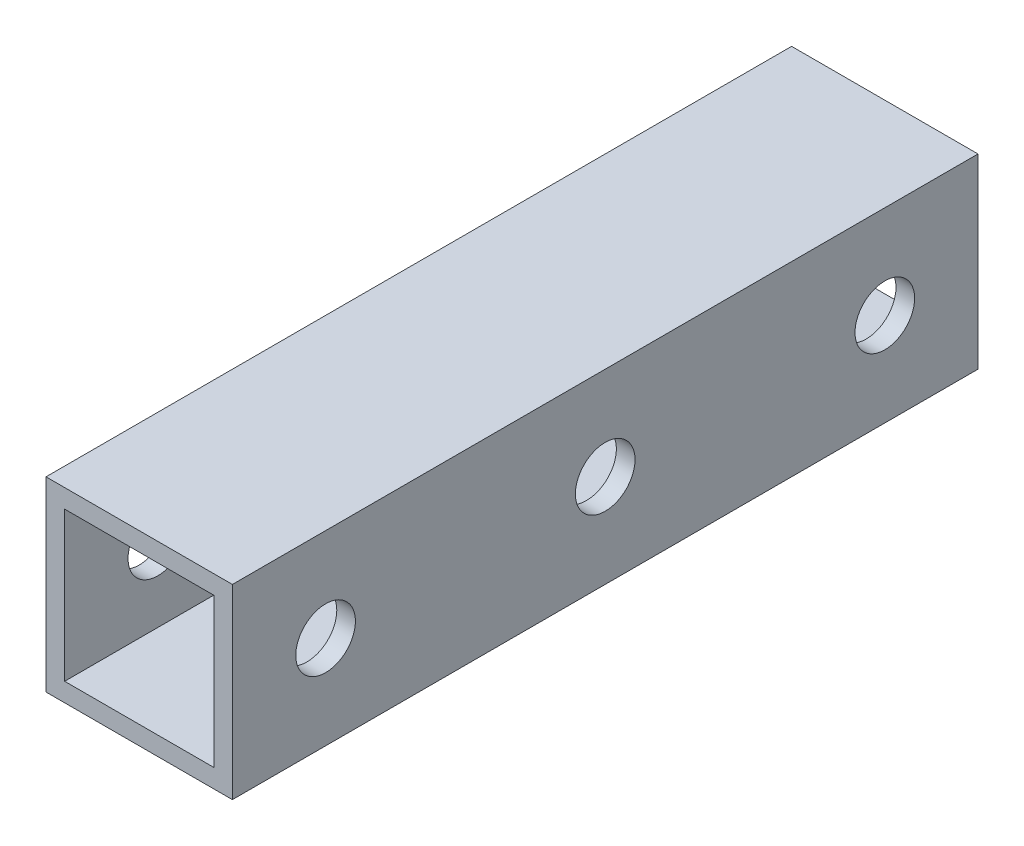
from build123d import *

# Parameters (mm, degrees)
SKETCH_1_W          = 10
SKETCH_1_H          = 10
SKETCH_1_W_2        = 8
SKETCH_1_H_2        = 8
EXTRUDE_1_DEPTH     = 40
SKETCH_3_R          = 1.6
CUT_EXTRUDE_2_DEPTH = 42.533119315


with BuildPart() as part:
    # ｽｹｯﾁ1 → 押し出し-薄板1 (new body)
    with BuildSketch(Plane.XY):
        Rectangle(SKETCH_1_W, SKETCH_1_H)
        Rectangle(SKETCH_1_W_2, SKETCH_1_H_2, mode=Mode.SUBTRACT)
    extrude(amount=EXTRUDE_1_DEPTH)

    # ｽｹｯﾁ3 → ｶｯﾄ - 押し出し2 (cut, through all)
    with BuildSketch(Plane(origin=(5, 0, 0), x_dir=(0, 0, -1), z_dir=(1, 0, 0))):
        with Locations((-35, 0)):
            Circle(SKETCH_3_R)
        with Locations((-20, 0)):
            Circle(SKETCH_3_R)
        with Locations((-5, 0)):
            Circle(SKETCH_3_R)
    extrude(amount=-CUT_EXTRUDE_2_DEPTH, mode=Mode.SUBTRACT)


solid = part.part
